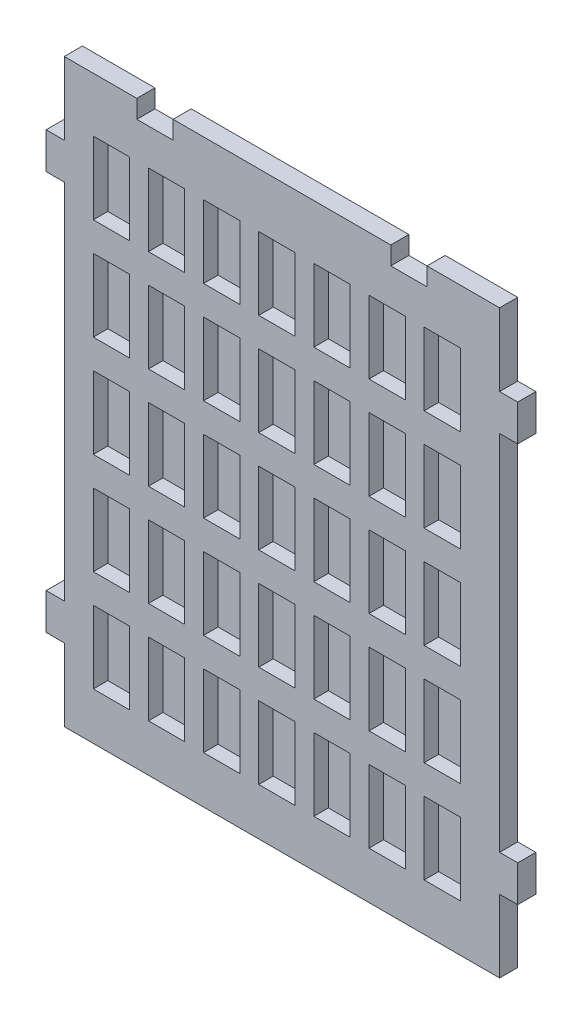
from build123d import *

# Parameters (mm, degrees)
BOSS_EXTRUDE1_DEPTH  = 3.175
SKETCH2_W            = 6.35
SKETCH2_H            = 12.7
CUT_EXTRUDE1_DEPTH   = 2.54
LPATTERN1_COUNT      = 7
LPATTERN1_PITCH      = 9.652
LPATTERN1_COUNT_DIR2 = 5
LPATTERN1_PITCH_DIR2 = 17.78


with BuildPart() as part:
    # Sketch1 → Boss-Extrude1 (new body)
    with BuildSketch(Plane.XY):
        Polygon((57.15, 0), (19.05, 0), (19.05, -3.175), (12.7, -3.175), (12.7, 0), (0, 0), (0, -12.7), (-3.175, -12.7), (-3.175, -19.05), (0, -19.05), (0, -82.55), (-3.175, -82.55), (-3.175, -88.9), (0, -88.9), (0, -101.6), (12.7, -101.6), (63.5, -101.6), (76.2, -101.6), (76.2, -88.9), (79.375, -88.9), (79.375, -82.55), (76.2, -82.55), (76.2, -19.05), (79.375, -19.05), (79.375, -12.7), (76.2, -12.7), (76.2, 0), (63.5, 0), (63.5, -3.175), (57.15, -3.175), align=None)
    extrude(amount=BOSS_EXTRUDE1_DEPTH)

    # Sketch2 → Cut-Extrude1 (cut)
    with BuildSketch(Plane.XY.offset(3.175)):
        with Locations((8.255, -15.875)):
            Rectangle(SKETCH2_W, SKETCH2_H)
    cut_extrude1 = extrude(amount=-CUT_EXTRUDE1_DEPTH, mode=Mode.SUBTRACT)

    # LPattern1: Cut-Extrude1 7 × 5
    with Locations(*[(i * LPATTERN1_PITCH, -j * LPATTERN1_PITCH_DIR2, 0) for i in range(LPATTERN1_COUNT) for j in range(LPATTERN1_COUNT_DIR2) if (i, j) != (0, 0)]):
        add(cut_extrude1, mode=Mode.SUBTRACT)


solid = part.part
